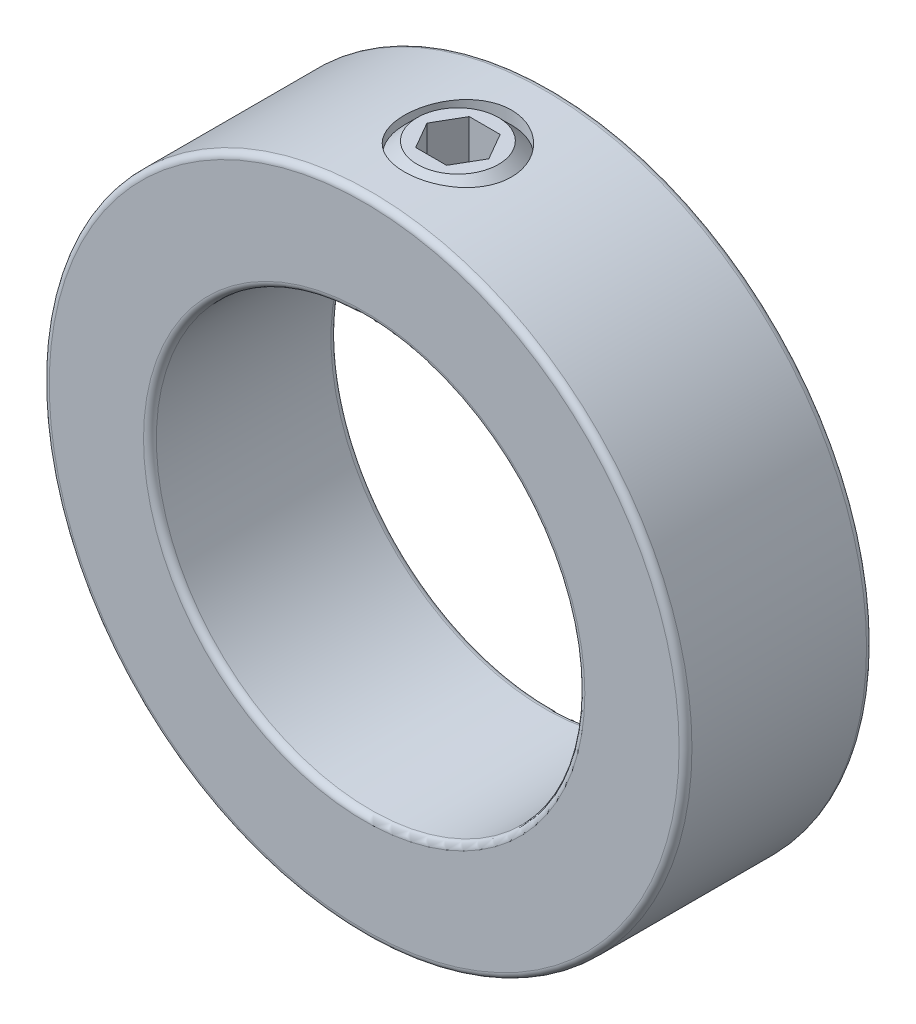
from build123d import *

# Parameters (mm, degrees)
SKETCH1_R          = 38.1
SKETCH1_R_2        = 25.4
EXTRUDE1_DEPTH     = 11.1125
SKETCH2_R          = 6.35
CUT_EXTRUDE1_DEPTH = 89.743947857
FILLET1_R          = 0.762
CUT_EXTRUDE2_DEPTH = 6.35


with BuildPart() as part:
    # Sketch1 → Extrude1 (new, symmetric)
    with BuildSketch(Plane.XY):
        Circle(SKETCH1_R)
        Circle(SKETCH1_R_2, mode=Mode.SUBTRACT)
    extrude(amount=EXTRUDE1_DEPTH, both=True)

    # Sketch2 → Cut-Extrude1 (cut, through all)
    with BuildSketch(Plane(origin=(41.275, 0, 0), x_dir=(0, 0, -1), z_dir=(0, -1, 0))):
        with Locations((0, -41.275)):
            Circle(SKETCH2_R)
    extrude(amount=-CUT_EXTRUDE1_DEPTH, mode=Mode.SUBTRACT)

    # Fillet1
    fillet1_edges = [part.edges().sort_by_distance(p)[0] for p in [
        (-38.1, 0, -11.1125),
        (-38.1, 0, 11.1125),
        (-25.4, 0, -11.1125),
        (-25.4, 0, 11.1125),
    ]]
    fillet(fillet1_edges, radius=FILLET1_R)


with BuildPart() as body_2:
    # Sketch3 → Revolve1 (revolve)
    with BuildSketch(Plane.XY):
        Polygon((-4.816385262, 25.4), (-1.840337685, 25.4), (0, 27.240337685), (0, 38.1), (-4.816385262, 38.1), (-6.35, 36.566385262), (-6.35, 26.933614738), align=None)
    revolve(axis=Axis((0, 25.4, 0), (0, -1, 0)))

    # Sketch4 → Cut-Extrude2 (cut)
    with BuildSketch(Plane(origin=(3.3734375, 38.1, 0), x_dir=(0, 0, -1), z_dir=(0, -1, 0))):
        Polygon((0, 0.292736709), (-3.175, -1.540350395), (-3.175, -5.206524605), (0, -7.039611709), (3.175, -5.206524605), (3.175, -1.540350395), align=None)
    extrude(amount=CUT_EXTRUDE2_DEPTH, mode=Mode.SUBTRACT)


solid = Compound([part.part, body_2.part])
